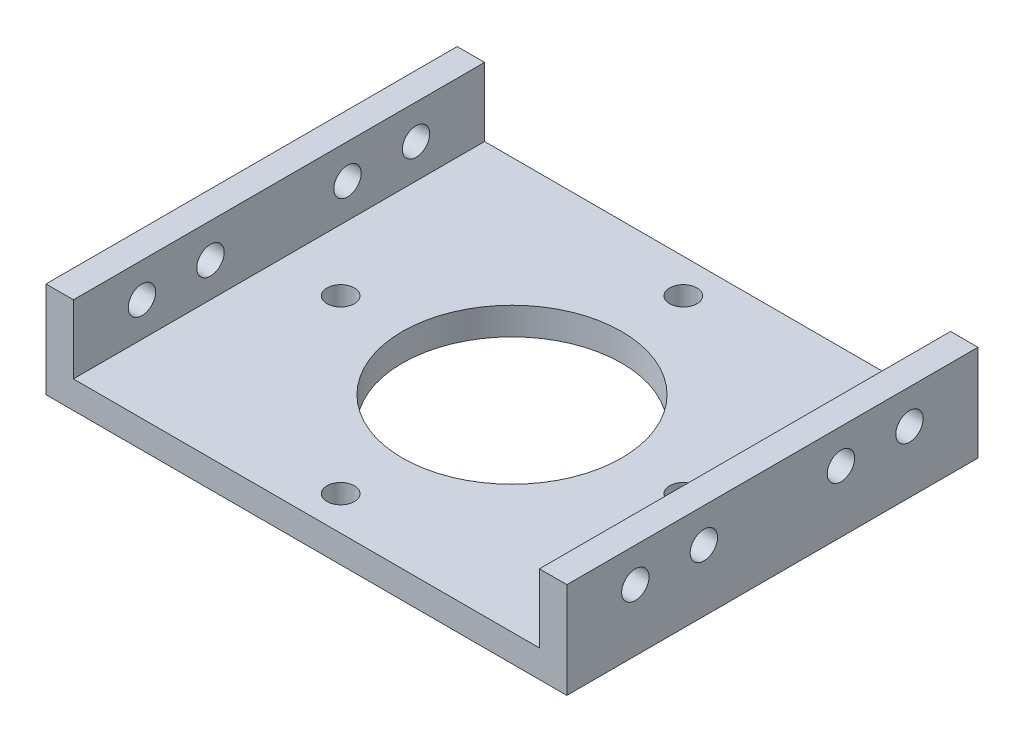
from build123d import *

# Parameters (mm, degrees)
EXTRUDE_1_DEPTH     = 30
CUT_EXTRUDE_1_REACH = 84.898
SKETCH_2_R          = 2
SKETCH_3_R          = 16
SKETCH_3_R_2        = 2
CUT_EXTRUDE_2_DEPTH = 4


with BuildPart() as part:
    # 草图1 → 凸台-拉伸1 (new, symmetric)
    with BuildSketch(Plane.XY):
        Polygon((38, 0), (-38, 0), (-38, 14), (-34, 14), (-34, 4), (34, 4), (34, 14), (38, 14), align=None)
    extrude(amount=EXTRUDE_1_DEPTH, both=True)

    # 切除-拉伸1: up to this face of the body (flat: up to its plane)
    cut_extrude_1_end = Plane(part.part.faces().sort_by_distance((-38, 7, 0))[0])
    # 草图2 → 切除-拉伸1 (cut, up to the picked face)
    with BuildSketch(Plane(origin=(38, 0, 0), x_dir=(0, 0, -1), z_dir=(1, 0, 0)), mode=Mode.PRIVATE) as cut_extrude_1_sk1:
        with Locations((-20, 9)):
            Circle(SKETCH_2_R)
    cut_extrude_1_tool1 = split(extrude(cut_extrude_1_sk1.sketch, amount=-CUT_EXTRUDE_1_REACH, mode=Mode.PRIVATE), bisect_by=cut_extrude_1_end, keep=Keep.BOTH, mode=Mode.PRIVATE)
    # 草图2 → 切除-拉伸1 (cut, up to the picked face)
    with BuildSketch(Plane(origin=(38, 0, 0), x_dir=(0, 0, -1), z_dir=(1, 0, 0)), mode=Mode.PRIVATE) as cut_extrude_1_sk2:
        with Locations((-10, 9)):
            Circle(SKETCH_2_R)
    cut_extrude_1_tool2 = split(extrude(cut_extrude_1_sk2.sketch, amount=-CUT_EXTRUDE_1_REACH, mode=Mode.PRIVATE), bisect_by=cut_extrude_1_end, keep=Keep.BOTH, mode=Mode.PRIVATE)
    # 草图2 → 切除-拉伸1 (cut, up to the picked face)
    with BuildSketch(Plane(origin=(38, 0, 0), x_dir=(0, 0, -1), z_dir=(1, 0, 0)), mode=Mode.PRIVATE) as cut_extrude_1_sk3:
        with Locations((10, 9)):
            Circle(SKETCH_2_R)
    cut_extrude_1_tool3 = split(extrude(cut_extrude_1_sk3.sketch, amount=-CUT_EXTRUDE_1_REACH, mode=Mode.PRIVATE), bisect_by=cut_extrude_1_end, keep=Keep.BOTH, mode=Mode.PRIVATE)
    # 草图2 → 切除-拉伸1 (cut, up to the picked face)
    with BuildSketch(Plane(origin=(38, 0, 0), x_dir=(0, 0, -1), z_dir=(1, 0, 0)), mode=Mode.PRIVATE) as cut_extrude_1_sk4:
        with Locations((20, 9)):
            Circle(SKETCH_2_R)
    cut_extrude_1_tool4 = split(extrude(cut_extrude_1_sk4.sketch, amount=-CUT_EXTRUDE_1_REACH, mode=Mode.PRIVATE), bisect_by=cut_extrude_1_end, keep=Keep.BOTH, mode=Mode.PRIVATE)
    add(cut_extrude_1_tool1.solids().sort_by(Axis((38, 9, 20), (-1, 0, 0)))[0], mode=Mode.SUBTRACT)
    add(cut_extrude_1_tool2.solids().sort_by(Axis((38, 9, 10), (-1, 0, 0)))[0], mode=Mode.SUBTRACT)
    add(cut_extrude_1_tool3.solids().sort_by(Axis((38, 9, -10), (-1, 0, 0)))[0], mode=Mode.SUBTRACT)
    add(cut_extrude_1_tool4.solids().sort_by(Axis((38, 9, -20), (-1, 0, 0)))[0], mode=Mode.SUBTRACT)

    # 草图3 → 切除-拉伸2 (cut)
    with BuildSketch(Plane(origin=(0, 4, 0), x_dir=(1, 0, 0), z_dir=(0, 1, 0))):
        with Locations(Location((0, 0, 0), (0, 0, 270))):
            Circle(SKETCH_3_R)
        with Locations(Location((0, 25, 0), (0, 0, 270))):
            Circle(SKETCH_3_R_2)
        with Locations(Location((25, 0, 0), (0, 0, 270))):
            Circle(SKETCH_3_R_2)
        with Locations(Location((0, -25, 0), (0, 0, 270))):
            Circle(SKETCH_3_R_2)
        with Locations(Location((-25, 0, 0), (0, 0, 270))):
            Circle(SKETCH_3_R_2)
    extrude(amount=-CUT_EXTRUDE_2_DEPTH, mode=Mode.SUBTRACT)


solid = part.part
